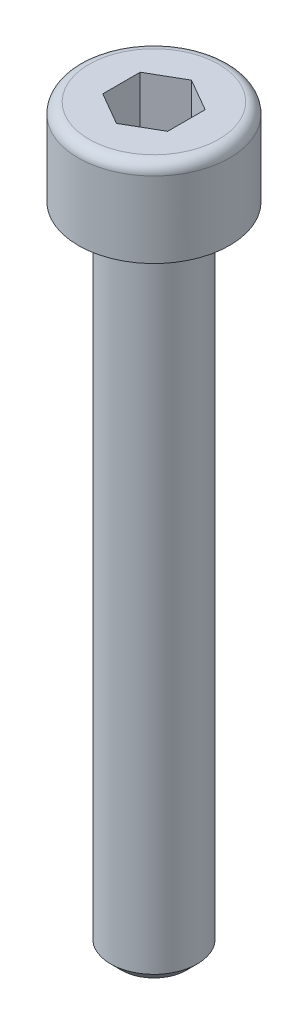
from build123d import *

# Parameters (mm, degrees)
CORTAR_EXTRUIR1_DEPTH = 3
CHAFL_N1_SIZE         = 0.5
REDONDEO1_R           = 0.5


with BuildPart() as part:
    # Croquis1 → Revolución1 (revolve)
    with BuildSketch(Plane.XY, mode=Mode.PRIVATE) as revoluci_n1_sk:
        Polygon((0, 0), (3.5, 0), (3.5, -4), (2, -4), (2, -34), (0, -34), align=None)
    revolve(revoluci_n1_sk.sketch.rotate(Axis((0, 0, 0), (0, -1, 0)), 90), axis=Axis((0, 0, 0), (0, -1, 0)))

    # Croquis2 → Cortar-Extruir1 (cut)
    with BuildSketch(Plane(origin=(0, 0, 0), x_dir=(1, 0, 0), z_dir=(0, 1, 0))):
        Polygon((1.5, 0.866025404), (0, 1.732050808), (-1.5, 0.866025404), (-1.5, -0.866025404), (0, -1.732050808), (1.5, -0.866025404), align=None)
    extrude(amount=-CORTAR_EXTRUIR1_DEPTH, mode=Mode.SUBTRACT)

    # Chaflán1
    chafl_n1_edges = [part.edges().sort_by_distance(p)[0] for p in [
        (0, -34, -2),
    ]]
    chamfer(chafl_n1_edges, length=CHAFL_N1_SIZE)

    # Redondeo1
    redondeo1_edges = [part.edges().sort_by_distance(p)[0] for p in [
        (0, 0, -3.5),
    ]]
    fillet(redondeo1_edges, radius=REDONDEO1_R)


solid = part.part
